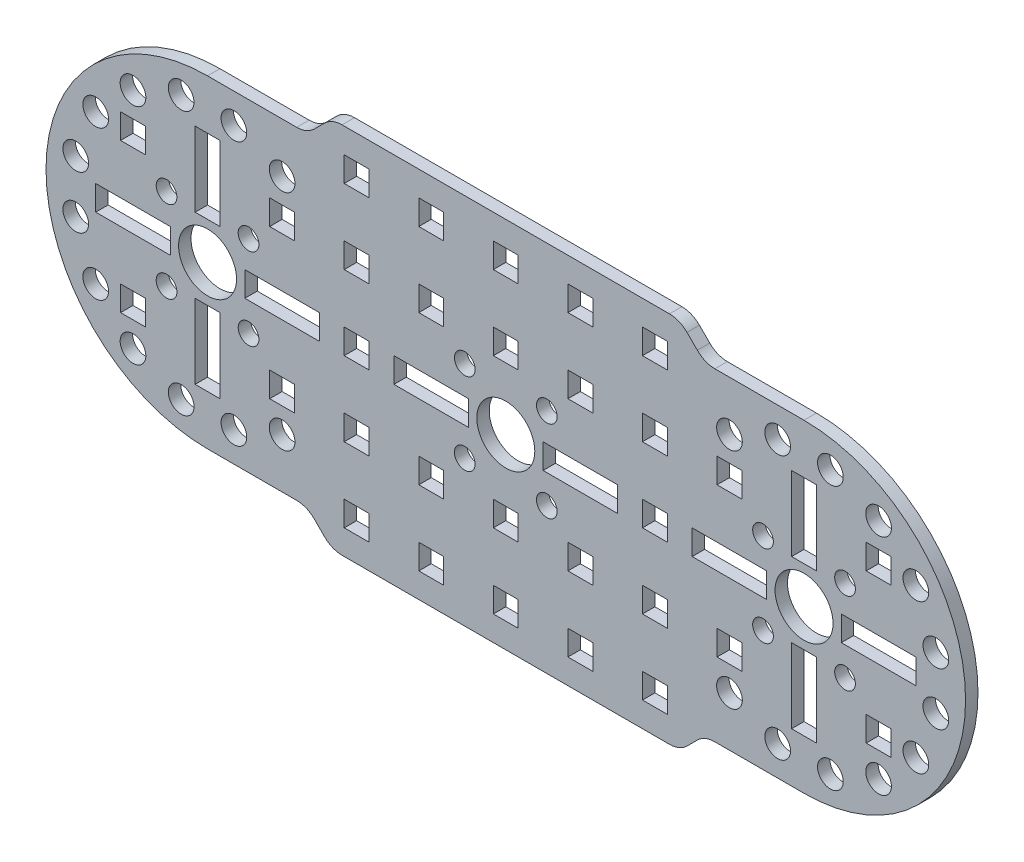
from build123d import *

# Parameters (mm, degrees)
MODEL_R                 = 1.25
MODEL_R_2               = 3.5
MODEL_R_3               = 1.55
MODEL_W                 = 9
MODEL_H                 = 3
MODEL_W_2               = 3
MODEL_H_2               = 9
SALIENTE_EXTRUIR1_DEPTH = 1.5


with BuildPart() as part:
    # Model → Saliente-Extruir1 (new body)
    with BuildSketch(Plane.XY):
        with BuildLine():
            Line((43.640298177, 300.645367074), (83.155016803, 300.645367074))
            ThreePointArc((83.155016803, 300.645367074), (84.3030671, 300.417005671), (85.276337146, 299.766687417))
            Line((85.276337146, 299.766687417), (86.518977834, 298.52404673))
            ThreePointArc((86.518977834, 298.52404673), (87.49224788, 297.873728476), (88.640298177, 297.645367074))
            Line((88.640298177, 297.645367074), (99.39765749, 297.645367074))
            ThreePointArc((99.39765749, 297.645367074), (118.89765749, 278.145367074), (99.39765749, 258.645367074))
            Line((99.39765749, 258.645367074), (88.640298177, 258.645367074))
            ThreePointArc((88.640298177, 258.645367074), (87.49224788, 258.417005671), (86.518977834, 257.766687417))
            Line((86.518977834, 257.766687417), (85.276337146, 256.52404673))
            ThreePointArc((85.276337146, 256.52404673), (84.3030671, 255.873728476), (83.155016803, 255.645367074))
            Line((83.155016803, 255.645367074), (43.640298177, 255.645367074))
            ThreePointArc((43.640298177, 255.645367074), (42.49224788, 255.873728476), (41.518977834, 256.52404673))
            Line((41.518977834, 256.52404673), (40.276337147, 257.766687417))
            ThreePointArc((40.276337147, 257.766687417), (39.3030671, 258.417005671), (38.155016803, 258.645367074))
            Line((38.155016803, 258.645367074), (27.39765749, 258.645367074))
            ThreePointArc((27.39765749, 258.645367074), (7.89765749, 278.145367074), (27.39765749, 297.645367074))
            Line((27.39765749, 297.645367074), (38.155016803, 297.645367074))
            ThreePointArc((38.155016803, 297.645367074), (39.3030671, 297.873728476), (40.276337147, 298.52404673))
            Line((40.276337147, 298.52404673), (41.518977834, 299.766687417))
            ThreePointArc((41.518977834, 299.766687417), (42.49224788, 300.417005671), (43.640298177, 300.645367074))
        make_face()
        with Locations((22.447910022, 283.095114542)):
            Circle(MODEL_R, mode=Mode.SUBTRACT)
        with Locations((22.447910022, 273.195619605)):
            Circle(MODEL_R, mode=Mode.SUBTRACT)
        with Locations((32.347404958, 273.195619605)):
            Circle(MODEL_R, mode=Mode.SUBTRACT)
        with Locations((32.347404958, 283.095114542)):
            Circle(MODEL_R, mode=Mode.SUBTRACT)
        with Locations((27.39765749, 278.145367074)):
            Circle(MODEL_R_2, mode=Mode.SUBTRACT)
        with Locations((18.39765749, 291.645367074)):
            Circle(MODEL_R_3, mode=Mode.SUBTRACT)
        with Locations((18.39765749, 264.645367074)):
            Circle(MODEL_R_3, mode=Mode.SUBTRACT)
        with Locations((36.39765749, 291.645367074)):
            Circle(MODEL_R_3, mode=Mode.SUBTRACT)
        with Locations((36.39765749, 264.645367074)):
            Circle(MODEL_R_3, mode=Mode.SUBTRACT)
        with Locations((13.89765749, 269.145367074)):
            Circle(MODEL_R_3, mode=Mode.SUBTRACT)
        with Locations((13.89765749, 287.145367074)):
            Circle(MODEL_R_3, mode=Mode.SUBTRACT)
        with Locations((30.579638005, 294.05526965)):
            Circle(MODEL_R_3, mode=Mode.SUBTRACT)
        with Locations((24.215676975, 262.235464497)):
            Circle(MODEL_R_3, mode=Mode.SUBTRACT)
        with Locations((30.579638005, 262.235464497)):
            Circle(MODEL_R_3, mode=Mode.SUBTRACT)
        with Locations((24.215676975, 294.05526965)):
            Circle(MODEL_R_3, mode=Mode.SUBTRACT)
        with Locations((11.487754913, 281.327347589)):
            Circle(MODEL_R_3, mode=Mode.SUBTRACT)
        with Locations((11.487754913, 274.963386558)):
            Circle(MODEL_R_3, mode=Mode.SUBTRACT)
        with Locations((94.447910022, 283.095114542)):
            Circle(MODEL_R, mode=Mode.SUBTRACT)
        with Locations((94.447910022, 273.195619605)):
            Circle(MODEL_R, mode=Mode.SUBTRACT)
        with Locations((104.347404958, 273.195619605)):
            Circle(MODEL_R, mode=Mode.SUBTRACT)
        with Locations((104.347404958, 283.095114542)):
            Circle(MODEL_R, mode=Mode.SUBTRACT)
        with Locations((99.39765749, 278.145367074)):
            Circle(MODEL_R_2, mode=Mode.SUBTRACT)
        with Locations((90.39765749, 291.645367074)):
            Circle(MODEL_R_3, mode=Mode.SUBTRACT)
        with Locations((90.39765749, 264.645367074)):
            Circle(MODEL_R_3, mode=Mode.SUBTRACT)
        with Locations((108.39765749, 291.645367074)):
            Circle(MODEL_R_3, mode=Mode.SUBTRACT)
        with Locations((108.39765749, 264.645367074)):
            Circle(MODEL_R_3, mode=Mode.SUBTRACT)
        with Locations((112.89765749, 269.145367074)):
            Circle(MODEL_R_3, mode=Mode.SUBTRACT)
        with Locations((112.89765749, 287.145367074)):
            Circle(MODEL_R_3, mode=Mode.SUBTRACT)
        with Locations((102.579638005, 294.05526965)):
            Circle(MODEL_R_3, mode=Mode.SUBTRACT)
        with Locations((96.215676975, 262.235464497)):
            Circle(MODEL_R_3, mode=Mode.SUBTRACT)
        with Locations((102.579638005, 262.235464497)):
            Circle(MODEL_R_3, mode=Mode.SUBTRACT)
        with Locations((96.215676975, 294.05526965)):
            Circle(MODEL_R_3, mode=Mode.SUBTRACT)
        with Locations((115.307560067, 274.963386558)):
            Circle(MODEL_R_3, mode=Mode.SUBTRACT)
        with Locations((115.307560067, 281.327347589)):
            Circle(MODEL_R_3, mode=Mode.SUBTRACT)
        with Locations((58.447910022, 283.095114542)):
            Circle(MODEL_R, mode=Mode.SUBTRACT)
        with Locations((58.447910022, 273.195619605)):
            Circle(MODEL_R, mode=Mode.SUBTRACT)
        with Locations((68.347404958, 273.195619605)):
            Circle(MODEL_R, mode=Mode.SUBTRACT)
        with Locations((68.347404958, 283.095114542)):
            Circle(MODEL_R, mode=Mode.SUBTRACT)
        with Locations((63.39765749, 278.145367074)):
            Circle(MODEL_R_2, mode=Mode.SUBTRACT)
        with Locations((36.39765749, 278.145367074)):
            Rectangle(MODEL_W, MODEL_H, mode=Mode.SUBTRACT)
        with Locations((27.39765749, 287.145367074)):
            Rectangle(MODEL_W_2, MODEL_H_2, mode=Mode.SUBTRACT)
        with Locations((18.39765749, 278.145367074)):
            Rectangle(MODEL_W, MODEL_H, mode=Mode.SUBTRACT)
        with Locations((27.39765749, 269.145367074)):
            Rectangle(MODEL_W_2, MODEL_H_2, mode=Mode.SUBTRACT)
        with Locations((108.39765749, 278.145367074)):
            Rectangle(MODEL_W, MODEL_H, mode=Mode.SUBTRACT)
        with Locations((99.39765749, 287.145367074)):
            Rectangle(MODEL_W_2, MODEL_H_2, mode=Mode.SUBTRACT)
        with Locations((90.39765749, 278.145367074)):
            Rectangle(MODEL_W, MODEL_H, mode=Mode.SUBTRACT)
        with Locations((99.39765749, 269.145367074)):
            Rectangle(MODEL_W_2, MODEL_H_2, mode=Mode.SUBTRACT)
        with Locations((72.39765749, 278.145367074)):
            Rectangle(MODEL_W, MODEL_H, mode=Mode.SUBTRACT)
        with Locations((54.39765749, 278.145367074)):
            Rectangle(MODEL_W, MODEL_H, mode=Mode.SUBTRACT)
        with Locations((18.39765749, 287.145367074)):
            Rectangle(MODEL_W_2, MODEL_H, mode=Mode.SUBTRACT)
        with Locations((36.39765749, 269.145367074)):
            Rectangle(MODEL_W_2, MODEL_H, mode=Mode.SUBTRACT)
        with Locations((90.39765749, 287.145367074)):
            Rectangle(MODEL_W_2, MODEL_H, mode=Mode.SUBTRACT)
        with Locations((36.39765749, 287.145367074)):
            Rectangle(MODEL_W_2, MODEL_H, mode=Mode.SUBTRACT)
        with Locations((45.39765749, 260.145367074)):
            Rectangle(MODEL_W_2, MODEL_H, mode=Mode.SUBTRACT)
        with Locations((81.39765749, 260.145367074)):
            Rectangle(MODEL_W_2, MODEL_H, mode=Mode.SUBTRACT)
        with Locations((18.39765749, 269.145367074)):
            Rectangle(MODEL_W_2, MODEL_H, mode=Mode.SUBTRACT)
        with Locations((45.39765749, 278.145367074)):
            Rectangle(MODEL_W_2, MODEL_H, mode=Mode.SUBTRACT)
        with Locations((108.39765749, 287.145367074)):
            Rectangle(MODEL_W_2, MODEL_H, mode=Mode.SUBTRACT)
        with Locations((90.39765749, 269.145367074)):
            Rectangle(MODEL_W_2, MODEL_H, mode=Mode.SUBTRACT)
        with Locations((81.39765749, 278.145367074)):
            Rectangle(MODEL_W_2, MODEL_H, mode=Mode.SUBTRACT)
        with Locations((108.39765749, 269.145367074)):
            Rectangle(MODEL_W_2, MODEL_H, mode=Mode.SUBTRACT)
        with Locations((54.39765749, 260.145367074)):
            Rectangle(MODEL_W_2, MODEL_H, mode=Mode.SUBTRACT)
        with Locations((63.39765749, 260.145367074)):
            Rectangle(MODEL_W_2, MODEL_H, mode=Mode.SUBTRACT)
        with Locations((72.39765749, 260.145367074)):
            Rectangle(MODEL_W_2, MODEL_H, mode=Mode.SUBTRACT)
        with Locations((45.39765749, 269.145367074)):
            Rectangle(MODEL_W_2, MODEL_H, mode=Mode.SUBTRACT)
        with Locations((81.39765749, 269.145367074)):
            Rectangle(MODEL_W_2, MODEL_H, mode=Mode.SUBTRACT)
        with Locations((54.39765749, 269.145367074)):
            Rectangle(MODEL_W_2, MODEL_H, mode=Mode.SUBTRACT)
        with Locations((63.39765749, 269.145367074)):
            Rectangle(MODEL_W_2, MODEL_H, mode=Mode.SUBTRACT)
        with Locations((72.39765749, 269.145367074)):
            Rectangle(MODEL_W_2, MODEL_H, mode=Mode.SUBTRACT)
        with Locations((45.39765749, 287.145367074)):
            Rectangle(MODEL_W_2, MODEL_H, mode=Mode.SUBTRACT)
        with Locations((81.39765749, 287.145367074)):
            Rectangle(MODEL_W_2, MODEL_H, mode=Mode.SUBTRACT)
        with Locations((54.39765749, 287.145367074)):
            Rectangle(MODEL_W_2, MODEL_H, mode=Mode.SUBTRACT)
        with Locations((63.39765749, 287.145367074)):
            Rectangle(MODEL_W_2, MODEL_H, mode=Mode.SUBTRACT)
        with Locations((72.39765749, 287.145367074)):
            Rectangle(MODEL_W_2, MODEL_H, mode=Mode.SUBTRACT)
        with Locations((45.39765749, 296.145367074)):
            Rectangle(MODEL_W_2, MODEL_H, mode=Mode.SUBTRACT)
        with Locations((81.39765749, 296.145367074)):
            Rectangle(MODEL_W_2, MODEL_H, mode=Mode.SUBTRACT)
        with Locations((54.39765749, 296.145367074)):
            Rectangle(MODEL_W_2, MODEL_H, mode=Mode.SUBTRACT)
        with Locations((63.39765749, 296.145367074)):
            Rectangle(MODEL_W_2, MODEL_H, mode=Mode.SUBTRACT)
        with Locations((72.39765749, 296.145367074)):
            Rectangle(MODEL_W_2, MODEL_H, mode=Mode.SUBTRACT)
    extrude(amount=SALIENTE_EXTRUIR1_DEPTH)


solid = part.part
